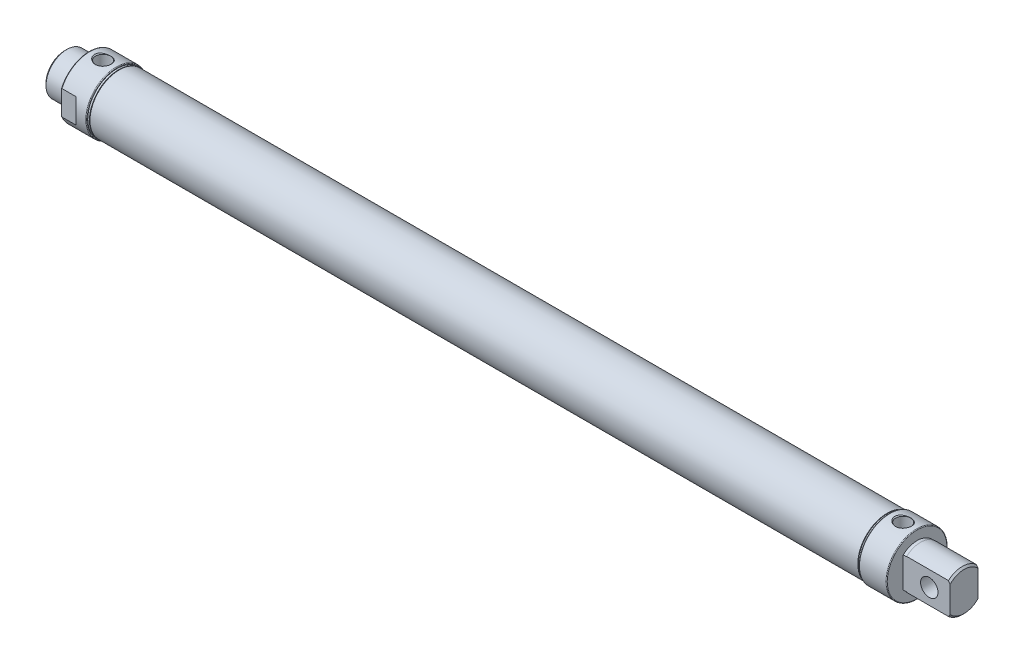
from build123d import *

# Parameters (mm, degrees)
SKETCH_3_W               = 36
SKETCH_3_H               = 44
SKETCH_3_W_2             = 16
SKETCH_3_H_2             = 24
CUT_EXTRUDE_1_DEPTH      = 27
SKETCH_4_W               = 16
SKETCH_4_H               = 5
CUT_EXTRUDE_2_DEPTH      = 35
CUT_EXTRUDE_2_DEPTH_BACK = 35


with BuildPart() as part:
    # 草图1 → 旋转1 (revolve)
    with BuildSketch(Plane.XY):
        with BuildLine():
            Line((0, 0), (0, 10.773))
            Line((0, 10.773), (1.227, 12))
            Line((1.227, 12), (14, 12))
            Line((14, 12), (14, 17.1))
            ThreePointArc((14, 17.1), (14.117157288, 17.382842712), (14.4, 17.5))
            Line((14.4, 17.5), (29.6, 17.5))
            ThreePointArc((29.6, 17.5), (29.882842712, 17.382842712), (30, 17.1))
            Line((30, 17.1), (30, 16.8))
            Line((30, 16.8), (31, 16.8))
            Line((31, 16.8), (31, 16.3))
            Line((31, 16.3), (31.3, 16.8))
            Line((31.3, 16.8), (472.7, 16.8))
            Line((472.7, 16.8), (473, 16.3))
            Line((473, 16.3), (473, 16.8))
            Line((473, 16.8), (474, 16.8))
            Line((474, 16.8), (474, 17.1))
            ThreePointArc((474, 17.1), (474.117157288, 17.382842712), (474.4, 17.5))
            Line((474.4, 17.5), (489.6, 17.5))
            ThreePointArc((489.6, 17.5), (489.882842712, 17.382842712), (490, 17.1))
            Line((490, 17.1), (490, 0))
            Line((490, 0), (0, 0))
        make_face()
    revolve(axis=Axis((490, 0, 0), (-1, 0, 0)))

    # 草图2 → 旋转2 (revolve)
    with BuildSketch(Plane.XY):
        Polygon((490, 0), (490, 11.85), (492, 11.85), (492, 12), (516, 12), (517, 11), (517, 0), align=None)
    revolve(axis=Axis((517, 0, 0), (-1, 0, 0)))

    # 草图3 → 切除-拉伸1 (cut)
    with BuildSketch(Plane(origin=(517, 0, 0), x_dir=(0, 0, -1), z_dir=(1, 0, 0))):
        Rectangle(SKETCH_3_W, SKETCH_3_H)
        Rectangle(SKETCH_3_W_2, SKETCH_3_H_2, mode=Mode.SUBTRACT)
    extrude(amount=-CUT_EXTRUDE_1_DEPTH, mode=Mode.SUBTRACT)

    # 草图4 → 切除-旋转1 (revolve, cut)
    with BuildSketch(Plane(origin=(505, 0, 0), x_dir=(0, 0, -1), z_dir=(1, 0, 0))):
        with Locations((0, 2.5)):
            Rectangle(SKETCH_4_W, SKETCH_4_H)
    revolve(axis=Axis((505, 0, -8), (0, 0, 1)), mode=Mode.SUBTRACT)

    # 草图5 → 切除-旋转2 (revolve, cut)
    with BuildSketch(Plane.XY):
        Polygon((22, 17.5), (26.864, 17.5), (26.283, 16.919), (26.283, 9.5), (22, 9.5), align=None)
    revolve(axis=Axis((22, 9.5, 0), (0, 1, 0)), mode=Mode.SUBTRACT)

    # 草图6 → 切除-旋转3 (revolve, cut)
    with BuildSketch(Plane.XY):
        Polygon((482, 17.5), (486.864, 17.5), (486.283, 16.919), (486.283, 9.5), (482, 9.5), align=None)
    revolve(axis=Axis((482, 9.5, 0), (0, 1, 0)), mode=Mode.SUBTRACT)

    # 草图7 → 切除-拉伸2 (cut, two sides: drawn at the far end of the back side and taken through both)
    with BuildSketch(Plane(origin=(0, 0, 0), x_dir=(1, 0, 0), z_dir=(0, 1, 0)).offset(-CUT_EXTRUDE_2_DEPTH_BACK)):
        Polygon((-4, -17.5), (24, -17.5), (22.5, -16), (-2, -16), (-2, 16), (22.5, 16), (24, 17.5), (-4, 17.5), align=None)
    extrude(amount=CUT_EXTRUDE_2_DEPTH + CUT_EXTRUDE_2_DEPTH_BACK, mode=Mode.SUBTRACT)

    # 草图8 → 切除-旋转4 (revolve, cut)
    with BuildSketch(Plane.XY):
        Polygon((0, 0), (0, 6), (41, 6), (41, 16), (463, 16), (463, 0), align=None)
    revolve(axis=Axis((463, 0, 0), (-1, 0, 0)), mode=Mode.SUBTRACT)


solid = part.part
